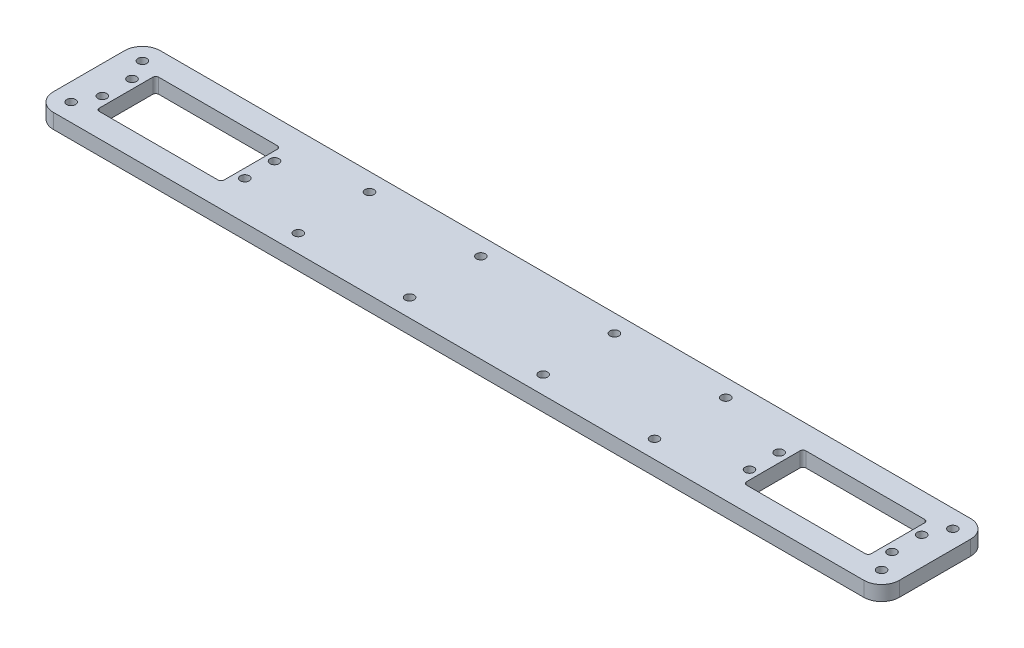
from build123d import *

# Parameters (mm, degrees)
SKETCH1_W           = 285
SKETCH1_H           = 36
SKETCH1_R           = 1.5
SKETCH1_W_2         = 42
SKETCH1_H_2         = 20
BOSS_EXTRUDE2_DEPTH = 5
FILLET1_R           = 6
FILLET2_R           = 1


with BuildPart() as part:
    # Sketch1 → Boss-Extrude2 (new body)
    with BuildSketch(Plane(origin=(0, 0, 0), x_dir=(1, 0, 0), z_dir=(0, 1, 0))):
        Rectangle(SKETCH1_W, SKETCH1_H)
        with Locations(Location((-85, -5, 0), (0, 0, 270))):
            Circle(SKETCH1_R, mode=Mode.SUBTRACT)
        with Locations(Location((-85, 5, 0), (0, 0, 270))):
            Circle(SKETCH1_R, mode=Mode.SUBTRACT)
        with Locations(Location((-133, 5, 0), (0, 0, 270))):
            Circle(SKETCH1_R, mode=Mode.SUBTRACT)
        with Locations(Location((-133, -5, 0), (0, 0, 270))):
            Circle(SKETCH1_R, mode=Mode.SUBTRACT)
        with Locations(Location((133, -5, 0), (0, 0, 90))):
            Circle(SKETCH1_R, mode=Mode.SUBTRACT)
        with Locations(Location((133, 5, 0), (0, 0, 90))):
            Circle(SKETCH1_R, mode=Mode.SUBTRACT)
        with Locations(Location((85, -5, 0), (0, 0, 90))):
            Circle(SKETCH1_R, mode=Mode.SUBTRACT)
        with Locations(Location((85, 5, 0), (0, 0, 90))):
            Circle(SKETCH1_R, mode=Mode.SUBTRACT)
        with Locations(Location((-22.5, -12, 0), (0, 0, 270))):
            Circle(SKETCH1_R, mode=Mode.SUBTRACT)
        with Locations(Location((-22.5, 12, 0), (0, 0, 90))):
            Circle(SKETCH1_R, mode=Mode.SUBTRACT)
        with Locations(Location((-136.5, -12, 0), (0, 0, 270))):
            Circle(SKETCH1_R, mode=Mode.SUBTRACT)
        with Locations(Location((-136.5, 12, 0), (0, 0, 90))):
            Circle(SKETCH1_R, mode=Mode.SUBTRACT)
        with Locations(Location((22.5, -12, 0), (0, 0, 90))):
            Circle(SKETCH1_R, mode=Mode.SUBTRACT)
        with Locations(Location((22.5, 12, 0), (0, 0, 270))):
            Circle(SKETCH1_R, mode=Mode.SUBTRACT)
        with Locations(Location((136.5, -12, 0), (0, 0, 90))):
            Circle(SKETCH1_R, mode=Mode.SUBTRACT)
        with Locations(Location((136.5, 12, 0), (0, 0, 270))):
            Circle(SKETCH1_R, mode=Mode.SUBTRACT)
        with Locations(Location((-60, 12, 0), (0, 0, 270))):
            Circle(SKETCH1_R, mode=Mode.SUBTRACT)
        with Locations(Location((-60, -12, 0), (0, 0, 90))):
            Circle(SKETCH1_R, mode=Mode.SUBTRACT)
        with Locations(Location((60, -12, 0), (0, 0, 270))):
            Circle(SKETCH1_R, mode=Mode.SUBTRACT)
        with Locations(Location((60, 12, 0), (0, 0, 90))):
            Circle(SKETCH1_R, mode=Mode.SUBTRACT)
        with Locations((-109, 0)):
            Rectangle(SKETCH1_W_2, SKETCH1_H_2, mode=Mode.SUBTRACT)
        with Locations((109, 0)):
            Rectangle(SKETCH1_W_2, SKETCH1_H_2, mode=Mode.SUBTRACT)
    extrude(amount=BOSS_EXTRUDE2_DEPTH)

    # Fillet1
    fillet1_edges = [part.edges().sort_by_distance(p)[0] for p in [
        (142.5, 2.5, 18),
        (-142.5, 2.5, 18),
        (-142.5, 2.5, -18),
        (142.5, 2.5, -18),
    ]]
    fillet(fillet1_edges, radius=FILLET1_R)

    # Fillet2
    fillet2_edges = [part.edges().sort_by_distance(p)[0] for p in [
        (-88, 2.5, 10),
        (-88, 2.5, -10),
        (-130, 2.5, -10),
        (-130, 2.5, 10),
        (130, 2.5, -10),
        (88, 2.5, -10),
        (88, 2.5, 10),
        (130, 2.5, 10),
    ]]
    fillet(fillet2_edges, radius=FILLET2_R)


solid = part.part
